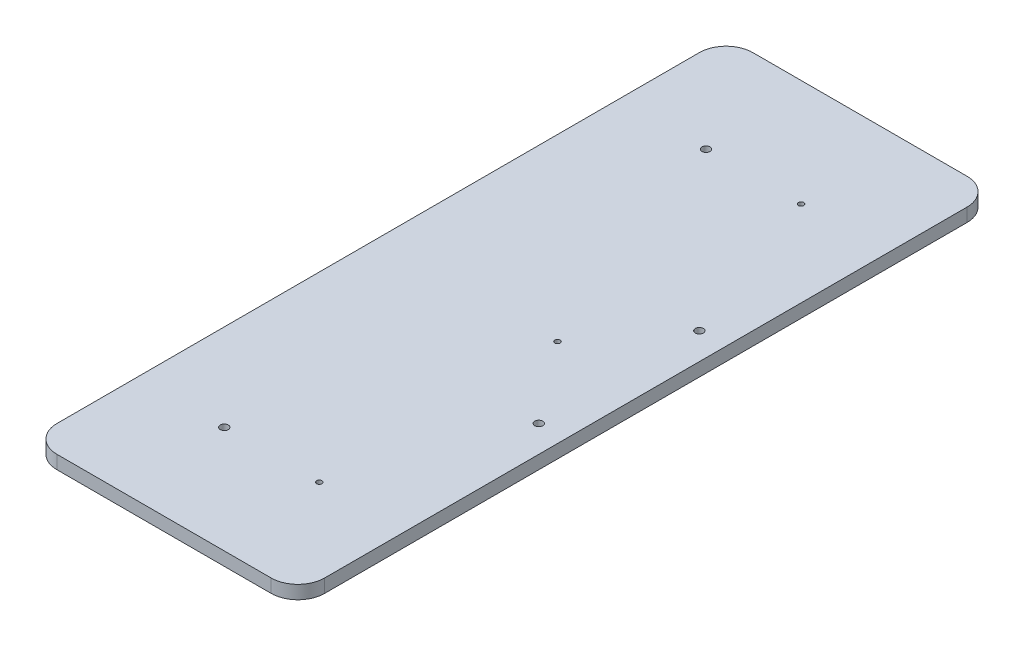
from build123d import *

# Parameters (mm, degrees)
SKETCH_1_W          = 300
SKETCH_1_H          = 200
EXTRUDE_1_DEPTH     = 5
EXTRUDE_2_DEPTH     = 5
SKETCH_6_W          = 200
SKETCH_6_H          = 200
CUT_EXTRUDE_4_DEPTH = 35
CUT_EXTRUDE_5_DEPTH = 50
SKETCH_8_W          = 100
SKETCH_8_H          = 260
EXTRUDE_3_DEPTH     = 5
SKETCH_9_R          = 1.5
CUT_EXTRUDE_6_DEPTH = 15
SKETCH_10_R         = 1.5
CUT_EXTRUDE_7_DEPTH = 15
SKETCH_11_R         = 1
CUT_EXTRUDE_8_DEPTH = 10
FILLET_5_R          = 10


with BuildPart() as part:
    # 草图1 → 凸台-拉伸1 (new body)
    with BuildSketch(Plane(origin=(0, 0, 0), x_dir=(1, 0, 0), z_dir=(0, 1, 0))):
        Rectangle(SKETCH_1_W, SKETCH_1_H)
    extrude(amount=EXTRUDE_1_DEPTH)

    # 草图5 → 凸台-拉伸2 (add)
    with BuildSketch(Plane(origin=(0, 5, 0), x_dir=(1, 0, 0), z_dir=(0, 1, 0))):
        Polygon((50, 100), (50, -100), (50, -130), (150, -130), (150, -100), (150, 100), (150, 130), (50, 130), align=None)
    extrude(amount=-EXTRUDE_2_DEPTH)

    # 草图6 → 切除-拉伸4 (cut)
    with BuildSketch(Plane(origin=(0, 5, 0), x_dir=(1, 0, 0), z_dir=(0, 1, 0))):
        with Locations((-50, 0)):
            Rectangle(SKETCH_6_W, SKETCH_6_H)
    extrude(amount=-CUT_EXTRUDE_4_DEPTH, mode=Mode.SUBTRACT)

    # 草图7 → 切除-拉伸5 (cut)
    with BuildSketch(Plane(origin=(0, 5, 0), x_dir=(1, 0, 0), z_dir=(0, 1, 0))):
        Polygon((142.5, -64.847184809), (142.5, -158.601088014), (197.194556245, -158.601088014), (197.194556245, 177.556552237), (142.5, 177.556552237), align=None)
    extrude(amount=-CUT_EXTRUDE_5_DEPTH, mode=Mode.SUBTRACT)

    # 草图8 → 凸台-拉伸3 (add)
    with BuildSketch(Plane(origin=(0, 5, 0), x_dir=(1, 0, 0), z_dir=(0, 1, 0))):
        with Locations((92.5, 0)):
            Rectangle(SKETCH_8_W, SKETCH_8_H)
    extrude(amount=-EXTRUDE_3_DEPTH)

    # 草图9 → 切除-拉伸6 (cut)
    with BuildSketch(Plane(origin=(0, 5, 0), x_dir=(1, 0, 0), z_dir=(0, 1, 0))):
        with Locations(Location((132.5, 30, 0), (0, 0, 270))):
            Circle(SKETCH_9_R)
        with Locations(Location((132.5, -30, 0), (0, 0, 270))):
            Circle(SKETCH_9_R)
    extrude(amount=-CUT_EXTRUDE_6_DEPTH, mode=Mode.SUBTRACT)

    # 草图10 → 切除-拉伸7 (cut)
    with BuildSketch(Plane(origin=(0, 5, 0), x_dir=(1, 0, 0), z_dir=(0, 1, 0))):
        with Locations(Location((75, 90, 0), (0, 0, 270))):
            Circle(SKETCH_10_R)
        with Locations(Location((75, -90, 0), (0, 0, 270))):
            Circle(SKETCH_10_R)
    extrude(amount=-CUT_EXTRUDE_7_DEPTH, mode=Mode.SUBTRACT)

    # 草图11 → 切除-拉伸8 (cut)
    with BuildSketch(Plane(origin=(0, 5, 0), x_dir=(1, 0, 0), z_dir=(0, 1, 0))):
        with Locations(Location((110.5, 90, 0), (0, 0, 270))):
            Circle(SKETCH_11_R)
        with Locations(Location((109.5, 0, 0), (0, 0, 270))):
            Circle(SKETCH_11_R)
        with Locations(Location((110.5, -90, 0), (0, 0, 270))):
            Circle(SKETCH_11_R)
    extrude(amount=-CUT_EXTRUDE_8_DEPTH, mode=Mode.SUBTRACT)

    # 圆角5
    fillet_5_edges = [part.edges().sort_by_distance(p)[0] for p in [
        (142.5, 2.5, -130),
        (142.5, 2.5, 130),
        (42.5, 2.5, 130),
        (42.5, 2.5, -130),
    ]]
    fillet(fillet_5_edges, radius=FILLET_5_R)


solid = part.part
